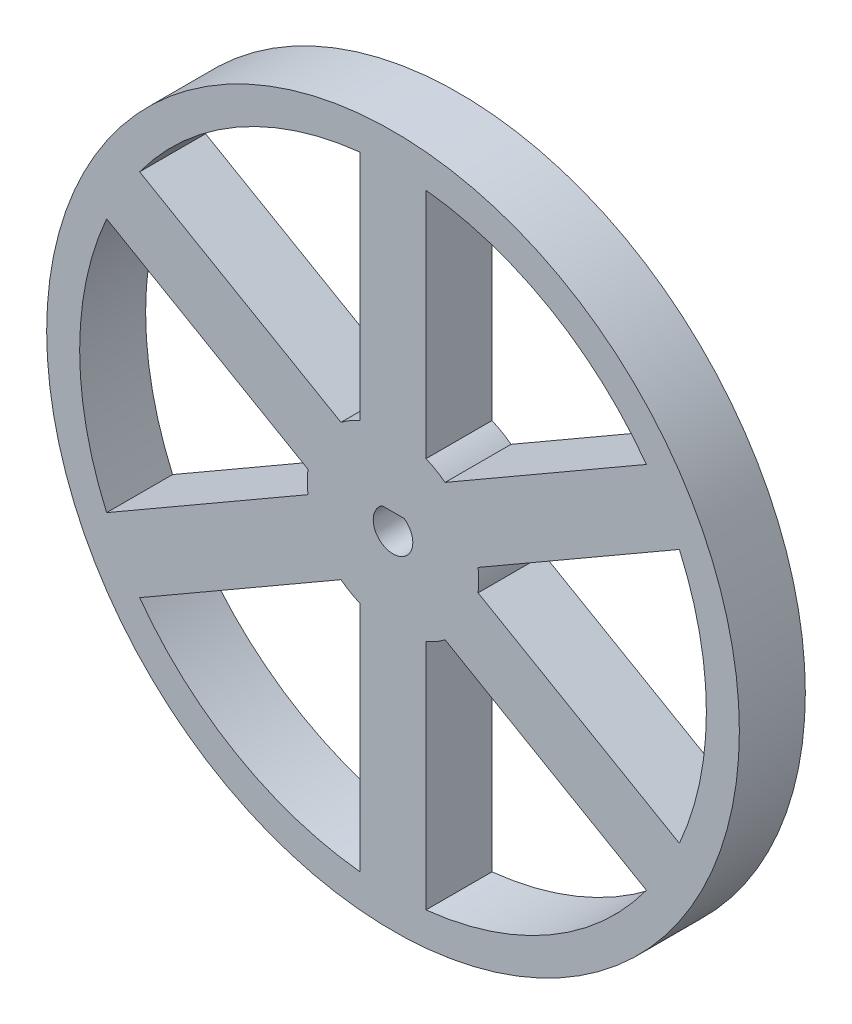
from build123d import *

# Parameters (mm, degrees)
SKETCH1_R           = 52.5
BOSS_EXTRUDE1_DEPTH = 10


with BuildPart() as part:
    # Sketch1 → Boss-Extrude1 (new body)
    with BuildSketch(Plane.XY):
        Circle(SKETCH1_R)
        with BuildLine():
            ThreePointArc((38.40767043, -27.948181554), (23.75, -41.13620668), (5, -47.236109069))
            Line((5, -47.236109069), (5, -12))
            ThreePointArc((5, -12), (6.5, -11.258330249), (7.892304845, -10.330127019))
            Line((7.892304845, -10.330127019), (38.40767043, -27.948181554))
        make_face(mode=Mode.SUBTRACT)
        with BuildLine():
            ThreePointArc((-5, -47.236109069), (-23.75, -41.13620668), (-38.40767043, -27.948181554))
            Line((-38.40767043, -27.948181554), (-7.892304845, -10.330127019))
            ThreePointArc((-7.892304845, -10.330127019), (-6.5, -11.258330249), (-5, -12))
            Line((-5, -12), (-5, -47.236109069))
        make_face(mode=Mode.SUBTRACT)
        with BuildLine():
            Line((-1.658312395, 2.5), (1.658312395, 2.5))
            ThreePointArc((1.658312395, 2.5), (0, -3), (-1.658312395, 2.5))
        make_face(mode=Mode.SUBTRACT)
        with BuildLine():
            ThreePointArc((-43.40767043, -19.287927516), (-47.5, 0), (-43.40767043, 19.287927516))
            Line((-43.40767043, 19.287927516), (-12.892304845, 1.669872981))
            ThreePointArc((-12.892304845, 1.669872981), (-13, 0), (-12.892304845, -1.669872981))
            Line((-12.892304845, -1.669872981), (-43.40767043, -19.287927516))
        make_face(mode=Mode.SUBTRACT)
        with BuildLine():
            Line((-5, 47.236109069), (-5, 12))
            ThreePointArc((-5, 12), (-6.5, 11.258330249), (-7.892304845, 10.330127019))
            Line((-7.892304845, 10.330127019), (-38.40767043, 27.948181554))
            ThreePointArc((-38.40767043, 27.948181554), (-23.75, 41.13620668), (-5, 47.236109069))
        make_face(mode=Mode.SUBTRACT)
        with BuildLine():
            ThreePointArc((43.40767043, 19.287927516), (47.5, 0), (43.40767043, -19.287927516))
            Line((43.40767043, -19.287927516), (12.892304845, -1.669872981))
            ThreePointArc((12.892304845, -1.669872981), (13, 0), (12.892304845, 1.669872981))
            Line((12.892304845, 1.669872981), (43.40767043, 19.287927516))
        make_face(mode=Mode.SUBTRACT)
        with BuildLine():
            ThreePointArc((5, 47.236109069), (23.75, 41.13620668), (38.40767043, 27.948181554))
            Line((38.40767043, 27.948181554), (7.892304845, 10.330127019))
            ThreePointArc((7.892304845, 10.330127019), (6.5, 11.258330249), (5, 12))
            Line((5, 12), (5, 47.236109069))
        make_face(mode=Mode.SUBTRACT)
    extrude(amount=BOSS_EXTRUDE1_DEPTH)


solid = part.part
